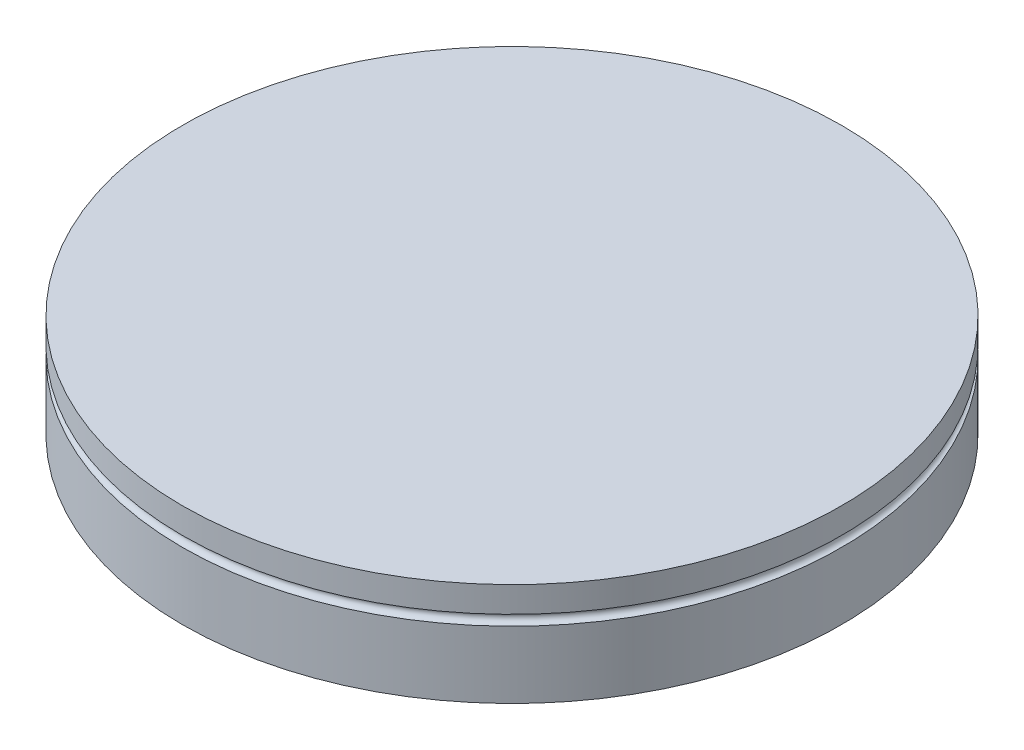
from build123d import *

# Parameters (mm, degrees)
SZKIC1_R                    = 64
DODANIE_WYCI_GNI_CIE1_DEPTH = 20
SZKIC3_R                    = 1


with BuildPart() as part:
    # Szkic1 → Dodanie-wyciągnięcie1 (new body)
    with BuildSketch(Plane(origin=(0, 0, 0), x_dir=(1, 0, 0), z_dir=(0, 1, 0))):
        with Locations(Location((0, 0, 0), (0, 0, 270))):
            Circle(SZKIC1_R)
    extrude(amount=DODANIE_WYCI_GNI_CIE1_DEPTH)

    # Szkic3 → Wycięcie-obrót1 (revolve, cut)
    with BuildSketch(Plane.XY, mode=Mode.PRIVATE) as wyci_cie_obr_t1_sk:
        with Locations((64, 14)):
            Circle(SZKIC3_R)
    revolve(wyci_cie_obr_t1_sk.sketch.rotate(Axis((0, 20, 0), (0, -1, 0)), 90), axis=Axis((0, 20, 0), (0, -1, 0)), mode=Mode.SUBTRACT)


solid = part.part
